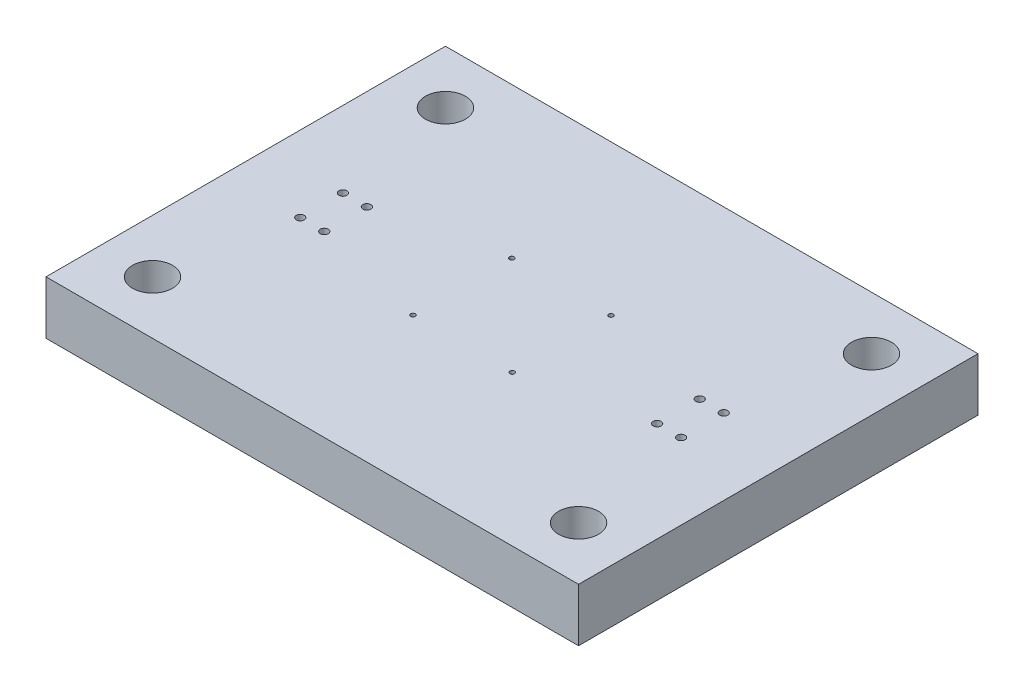
from build123d import *

# Parameters (mm, degrees)
SKETCH1_W               = 200
SKETCH1_H               = 150
BOSS_EXTRUDE1_DEPTH     = 20
SKETCH2_R               = 7.5
CUT_EXTRUDE1_DEPTH      = 127.589889012
CUT_EXTRUDE2_DEPTH      = 127.589889012
CUT_EXTRUDE2_DEPTH_BACK = 127.589889012
SKETCH3_R               = 1.5
SKETCH4_R               = 0.875
CUT_EXTRUDE3_DEPTH      = 127.589889012


with BuildPart() as part:
    # Sketch1 → Boss-Extrude1 (new body)
    with BuildSketch(Plane(origin=(0, 0, 0), x_dir=(1, 0, 0), z_dir=(0, 1, 0))):
        Rectangle(SKETCH1_W, SKETCH1_H)
    extrude(amount=BOSS_EXTRUDE1_DEPTH)

    # Sketch2 → Cut-Extrude1 (cut, through all)
    with BuildSketch(Plane(origin=(0, 20, 0), x_dir=(1, 0, 0), z_dir=(0, 1, 0))):
        with Locations(Location((-80, 55, 0), (0, 0, 270))):
            Circle(SKETCH2_R)
        with Locations(Location((80, 55, 0), (0, 0, 90))):
            Circle(SKETCH2_R)
        with Locations(Location((-80, -55, 0), (0, 0, 90))):
            Circle(SKETCH2_R)
        with Locations(Location((80, -55, 0), (0, 0, 270))):
            Circle(SKETCH2_R)
    extrude(amount=-CUT_EXTRUDE1_DEPTH, mode=Mode.SUBTRACT)

    # Sketch3 → Cut-Extrude2 (cut, two sides: drawn at the far end of the back side and taken through both)
    with BuildSketch(Plane.XZ.offset(-CUT_EXTRUDE2_DEPTH_BACK)):
        with Locations(Location((-71.5, 8, 0), (0, 0, 270))):
            Circle(SKETCH3_R)
        with Locations(Location((-62.5, 8, 0), (0, 0, 90))):
            Circle(SKETCH3_R)
        with Locations(Location((-62.5, -8, 0), (0, 0, 270))):
            Circle(SKETCH3_R)
        with Locations(Location((-71.5, -8, 0), (0, 0, 90))):
            Circle(SKETCH3_R)
        with Locations(Location((62.5, -8, 0), (0, 0, 90))):
            Circle(SKETCH3_R)
        with Locations(Location((71.5, -8, 0), (0, 0, 270))):
            Circle(SKETCH3_R)
        with Locations(Location((62.5, 8, 0), (0, 0, 270))):
            Circle(SKETCH3_R)
        with Locations(Location((71.5, 8, 0), (0, 0, 90))):
            Circle(SKETCH3_R)
    extrude(amount=CUT_EXTRUDE2_DEPTH + CUT_EXTRUDE2_DEPTH_BACK, mode=Mode.SUBTRACT)

    # Sketch4 → Cut-Extrude3 (cut, through all)
    with BuildSketch(Plane(origin=(0, 20, 0), x_dir=(1, 0, 0), z_dir=(0, 1, 0))):
        with Locations(Location((-18.63, 18.55, 0), (0, 0, 270))):
            Circle(SKETCH4_R)
        with Locations(Location((18.63, 18.55, 0), (0, 0, 90))):
            Circle(SKETCH4_R)
        with Locations(Location((-18.63, -18.55, 0), (0, 0, 90))):
            Circle(SKETCH4_R)
        with Locations(Location((18.63, -18.55, 0), (0, 0, 270))):
            Circle(SKETCH4_R)
    extrude(amount=-CUT_EXTRUDE3_DEPTH, mode=Mode.SUBTRACT)


solid = part.part
